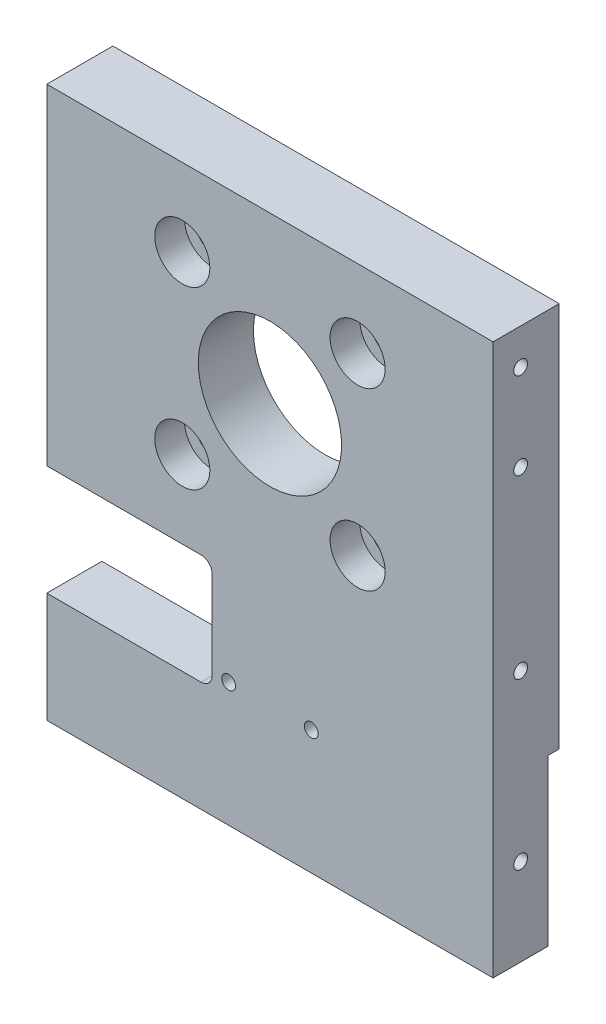
from build123d import *

# Parameters (mm, degrees)
SKETCH_1_W                   = 81
SKETCH_1_H                   = 100
EXTRUDE_1_DEPTH              = 12
SKETCH_2_R                   = 13
CUT_EXTRUDE_1_DEPTH          = 66.454182448
HOLE_WIZARD_M5_1_D           = 5.5
HOLE_WIZARD_M5_1_CBORE_D     = 10
HOLE_WIZARD_M5_1_CBORE_DEPTH = 5.4
HOLE_WIZARD_M3_1_AT_2_COUNT  = 2
HOLE_WIZARD_M3_1_AT_2_PITCH  = 15.7
HOLE_WIZARD_M3_1_AT_3_COUNT  = 2
HOLE_WIZARD_M3_1_AT_3_PITCH  = 47.7
HOLE_WIZARD_M3_1_AT_4_COUNT  = 2
HOLE_WIZARD_M3_1_AT_4_PITCH  = 77.7
SKETCH_9_R                   = 16.5
CUT_EXTRUDE_2_DEPTH          = 2
SKETCH_10_W                  = 81
SKETCH_10_H                  = 30
CUT_EXTRUDE_3_DEPTH          = 2
SKETCH_11_W                  = 60
SKETCH_11_H                  = 20
CUT_EXTRUDE_4_DEPTH          = 84
FILLET_1_R                   = 2
HOLE_WIZARD_M3_2_D           = 2.5
HOLE_WIZARD_M3_2_DEPTH       = 7.5
HOLE_WIZARD_M3_2_TIP         = 0.751075774


with BuildPart() as part:
    # 草图1 → 凸台-拉伸1 (new body)
    with BuildSketch(Plane.XY):
        Rectangle(SKETCH_1_W, SKETCH_1_H)
    extrude(amount=EXTRUDE_1_DEPTH)

    # 草图2 → 切除-拉伸1 (cut, through all)
    with BuildSketch(Plane(origin=(0, 0, 0), x_dir=(-1, 0, 0), z_dir=(0, 0, -1))):
        with Locations((0, 20)):
            Circle(SKETCH_2_R)
    extrude(amount=-CUT_EXTRUDE_1_DEPTH, mode=Mode.SUBTRACT)

    # M5 六角凹头螺钉的柱形沉头孔1 (through all)
    with Locations(Plane.XY.offset(12)):
        with Locations((-15.909902577, 35.909902577), (15.909902577, 35.909902577), (15.909902577, 4.090097423), (-15.909902577, 4.090097423), (0, 20)):
            CounterBoreHole(HOLE_WIZARD_M5_1_D / 2, HOLE_WIZARD_M5_1_CBORE_D / 2, HOLE_WIZARD_M5_1_CBORE_DEPTH)

    # 草图7 → M3 螺纹孔1 (revolve, cut)
    with BuildSketch(Plane(origin=(-40.5, 43.5, 7), x_dir=(0, 0, 1), z_dir=(0, 1, 0))):
        Polygon((0, 0), (0, 8.251075774), (1.25, 7.5), (1.25, 0), align=None)
    hole_wizard_m3_1 = revolve(axis=Axis((-46.85, 43.5, 7), (1, 0, 0)), mode=Mode.SUBTRACT)

    # M3 螺纹孔1 at 2: M3 螺纹孔1 ×2
    with Locations(*[(0, -i * HOLE_WIZARD_M3_1_AT_2_PITCH, 0) for i in range(1, HOLE_WIZARD_M3_1_AT_2_COUNT)]):
        add(hole_wizard_m3_1, mode=Mode.SUBTRACT)

    # M3 螺纹孔1 at 3: M3 螺纹孔1 ×2
    with Locations(*[(0, -i * HOLE_WIZARD_M3_1_AT_3_PITCH, 0) for i in range(1, HOLE_WIZARD_M3_1_AT_3_COUNT)]):
        add(hole_wizard_m3_1, mode=Mode.SUBTRACT)

    # M3 螺纹孔1 at 4: M3 螺纹孔1 ×2
    with Locations(*[(0, -i * HOLE_WIZARD_M3_1_AT_4_PITCH, 0) for i in range(1, HOLE_WIZARD_M3_1_AT_4_COUNT)]):
        add(hole_wizard_m3_1, mode=Mode.SUBTRACT)

    # 镜向1: M3 螺纹孔1 across plane
    add(hole_wizard_m3_1.mirror(Plane(origin=(0, 0, 0), x_dir=(0, 0, 1), z_dir=(1, 0, 0))), mode=Mode.SUBTRACT)

    # 镜向1 copy 1 sketch → 镜向1 copy 1 (revolve, cut)
    with BuildSketch(Plane(origin=(40.5, 27.8, 7), x_dir=(0, 0, 1), z_dir=(0, 1, 0))):
        Polygon((0, 0), (0, -8.251075774), (1.25, -7.5), (1.25, 0), align=None)
    revolve(axis=Axis((46.85, 27.8, 7), (1, 0, 0)), mode=Mode.SUBTRACT)

    # 镜向1 copy 2 sketch → 镜向1 copy 2 (revolve, cut)
    with BuildSketch(Plane(origin=(40.5, -4.2, 7), x_dir=(0, 0, 1), z_dir=(0, 1, 0))):
        Polygon((0, 0), (0, -8.251075774), (1.25, -7.5), (1.25, 0), align=None)
    revolve(axis=Axis((46.85, -4.2, 7), (1, 0, 0)), mode=Mode.SUBTRACT)

    # 镜向1 copy 3 sketch → 镜向1 copy 3 (revolve, cut)
    with BuildSketch(Plane(origin=(40.5, -34.2, 7), x_dir=(0, 0, 1), z_dir=(0, 1, 0))):
        Polygon((0, 0), (0, -8.251075774), (1.25, -7.5), (1.25, 0), align=None)
    revolve(axis=Axis((46.85, -34.2, 7), (1, 0, 0)), mode=Mode.SUBTRACT)

    # 草图9 → 切除-拉伸2 (cut)
    with BuildSketch(Plane(origin=(0, 0, 0), x_dir=(-1, 0, 0), z_dir=(0, 0, -1))):
        with Locations((0, 20)):
            Circle(SKETCH_9_R)
    extrude(amount=-CUT_EXTRUDE_2_DEPTH, mode=Mode.SUBTRACT)

    # 草图10 → 切除-拉伸3 (cut)
    with BuildSketch(Plane(origin=(0, 0, 0), x_dir=(-1, 0, 0), z_dir=(0, 0, -1))):
        with Locations((0, -35)):
            Rectangle(SKETCH_10_W, SKETCH_10_H)
    extrude(amount=-CUT_EXTRUDE_3_DEPTH, mode=Mode.SUBTRACT)

    # 草图11 → 切除-拉伸4 (cut)
    with BuildSketch(Plane(origin=(0, 0, 0), x_dir=(-1, 0, 0), z_dir=(0, 0, -1))):
        with Locations((40.5, -20)):
            Rectangle(SKETCH_11_W, SKETCH_11_H)
    extrude(amount=-CUT_EXTRUDE_4_DEPTH, mode=Mode.SUBTRACT)

    # 圆角1
    fillet_1_edges = [part.edges().sort_by_distance(p)[0] for p in [
        (-10.5, -10, 6),
        (-10.5, -30, 7),
    ]]
    fillet(fillet_1_edges, radius=FILLET_1_R)

    # M3 螺纹孔2
    with Locations(Plane.XY.offset(12)):
        with Locations((7.5, -27.5), (-7.5, -27.5)):
            Hole(HOLE_WIZARD_M3_2_D / 2, depth=HOLE_WIZARD_M3_2_DEPTH)
            with Locations((0, 0, -(HOLE_WIZARD_M3_2_DEPTH + HOLE_WIZARD_M3_2_TIP / 2))):  # 118° drill point
                Cone(0, HOLE_WIZARD_M3_2_D / 2, HOLE_WIZARD_M3_2_TIP, mode=Mode.SUBTRACT)


solid = part.part
